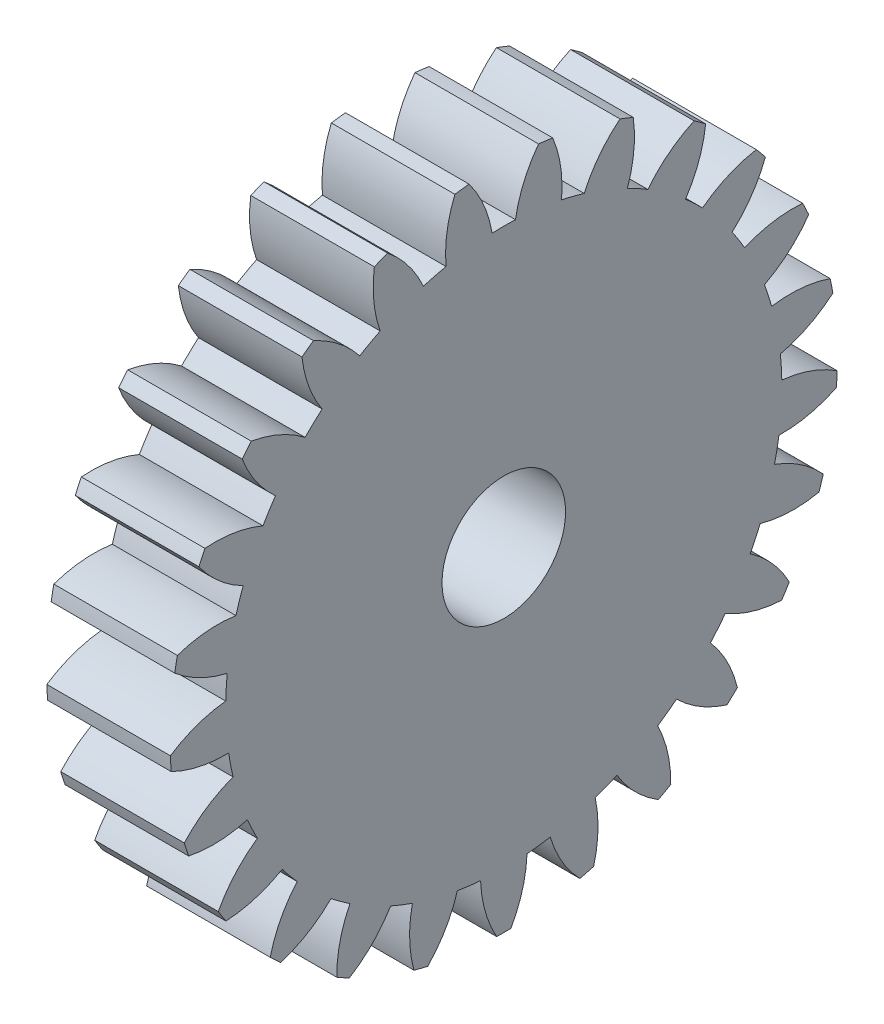
from build123d import *

# Parameters (mm, degrees)
BASPROSKE_W     = 10
BASPROSKE_H     = 27
TOOTHCUT_DEPTH  = 40.471508712
TEETHCUTS_COUNT = 25
TEETHCUTS_ANGLE = 345.6
BORSKE_R        = 5
BORE_DEPTH      = 50.0000508


with BuildPart() as part:
    # BasProSke → Base-Revolve (revolve)
    with BuildSketch(Plane(origin=(0, 0, 0), x_dir=(1, 0, 0), z_dir=(0, 1, 0)), mode=Mode.PRIVATE) as base_revolve_sk:
        with Locations((5, 13.5)):
            Rectangle(BASPROSKE_W, BASPROSKE_H)
    revolve(base_revolve_sk.sketch.rotate(Axis((-10, 0, 0), (1, 0, 0)), 180), axis=Axis((-10, 0, 0), (1, 0, 0)))

    # TooCutSke → ToothCut (cut, through all)
    with BuildSketch(Plane(origin=(0, 0, 0), x_dir=(0, 0, -1), z_dir=(1, 0, 0))):
        with BuildLine():
            ThreePointArc((0.946154762, 22.479096783), (0, 22.499), (-0.946154762, 22.479096783))
            ThreePointArc((-0.946154762, 22.479096783), (-1.62094792, 24.792268013), (-2.829470045, 26.876873784))
            ThreePointArc((-2.829470045, 26.876873784), (0, 27.0254), (2.829470045, 26.876873784))
            ThreePointArc((2.829470045, 26.876873784), (1.62094792, 24.792268013), (0.946154762, 22.479096783))
        make_face()
    toothcut = extrude(amount=TOOTHCUT_DEPTH, mode=Mode.SUBTRACT)

    # TeethCuts: ToothCut ×25 about axis
    teethcuts_axis = Axis((-10, 0, 0), (1, 0, 0))
    for i in range(1, TEETHCUTS_COUNT):
        add(toothcut.rotate(teethcuts_axis, i * TEETHCUTS_ANGLE / (TEETHCUTS_COUNT - 1)), mode=Mode.SUBTRACT)

    # BorSke → Bore (cut, symmetric)
    with BuildSketch(Plane(origin=(0, 0, 0), x_dir=(0, 0, -1), z_dir=(1, 0, 0))):
        with Locations(Location((0, 0, 0), (0, 0, 180))):
            Circle(BORSKE_R)
    extrude(amount=BORE_DEPTH, both=True, mode=Mode.SUBTRACT)


solid = part.part
